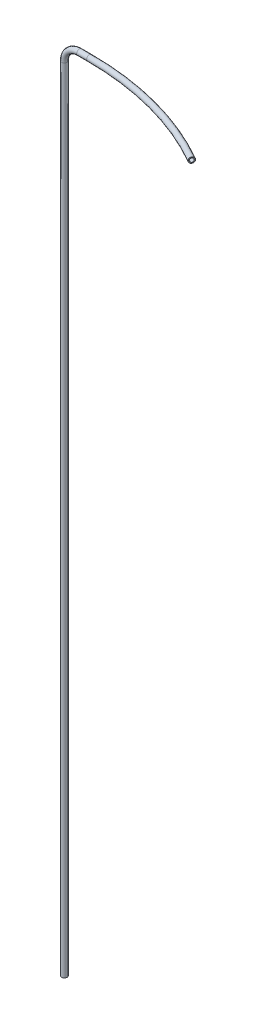
from build123d import *

# Parameters (mm, degrees)
SKETCH_1_R      = 6
SKETCH_1_R_2    = 4
REVOLVE_1_ANGLE = 30
SKETCH_2_R      = 15
SKETCH_2_R_2    = 10
SKETCH_2_R_3    = 6
SKETCH_2_R_4    = 4
SKETCH_11_R     = 6
SKETCH_11_R_2   = 4
EXTRUDE_1_DEPTH = 800


with BuildPart() as part:
    # 草图1 → 旋转1 (revolve)
    with BuildSketch(Plane(origin=(0, 0, 0), x_dir=(0, 0, -1), z_dir=(1, 0, 0))):
        with Locations((1300, -0.371055822)):
            Circle(SKETCH_1_R)
        with Locations((1300, -0.371055822)):
            Circle(SKETCH_1_R_2, mode=Mode.SUBTRACT)
    revolve(axis=Axis((0, 0, -700), (0, -1, 0)), revolution_arc=REVOLVE_1_ANGLE)

    # 扫描1: sweep along a path in 草图3
    with BuildLine(Plane.YX.offset(500)) as sweep_1_path:
        Line((0, 0), (0, -21.341132523))
        ThreePointArc((0, -21.341132523), (-9.589995058, -44.493428655), (-32.742291189, -54.083423712))
        Line((-32.742291189, -54.083423712), (-932.742291189, -54.083423712))
    # 草图2 → 扫描1 (sweep)
    # profile 1 of 2: a face of its own
    with BuildSketch(Plane.ZY):
        with Locations((-500, -0.371055822)):
            Circle(SKETCH_2_R)
        with Locations((-500, -0.371055822)):
            Circle(SKETCH_2_R_2, mode=Mode.SUBTRACT)
    # profile 2 of 2: a face of its own
    with BuildSketch(Plane.ZY):
        with Locations((-1300, -0.371055822)):
            Circle(SKETCH_2_R_3)
        with Locations((-1300, -0.371055822)):
            Circle(SKETCH_2_R_4, mode=Mode.SUBTRACT)
    sweep(path=sweep_1_path.line)


with BuildPart() as sweep_1_kept_piece:
    # of the separate pieces the step leaves, the one the design keeps (sweep_1_pieces_kept)
    add(part.part.solids().sort_by_distance((0, -0.371055822, -1306))[0])

    # 草图11 → 凸台-拉伸1 (add)
    with BuildSketch(Plane.XZ.offset(932.742291189)):
        with Locations((-53.712367891, -1300)):
            Circle(SKETCH_11_R)
        with Locations((-53.712367891, -1300)):
            Circle(SKETCH_11_R_2, mode=Mode.SUBTRACT)
    extrude(amount=EXTRUDE_1_DEPTH)


solid = sweep_1_kept_piece.part
